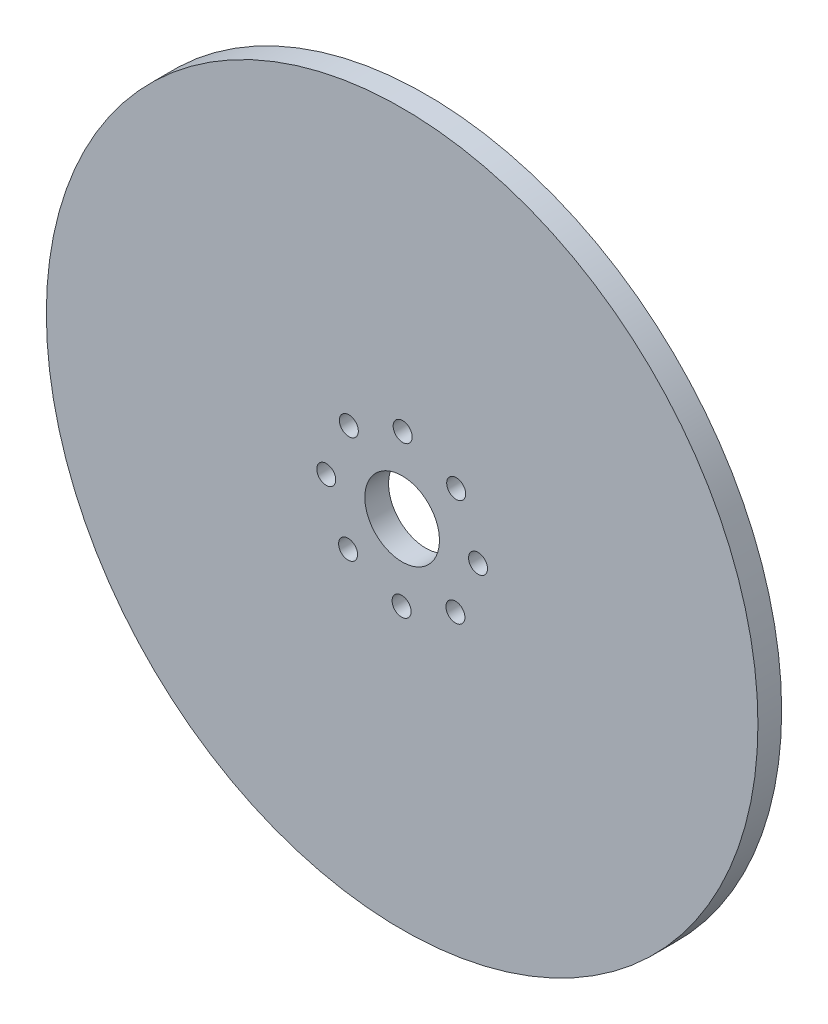
from build123d import *

# Parameters (mm, degrees)
SKETCH1_R           = 37.5
BOSS_EXTRUDE1_DEPTH = 2.5
SKETCH2_R           = 3.933222312
SKETCH2_R_2         = 1
SKETCH2_R_3         = 1.00109015
CUT_EXTRUDE1_DEPTH  = 54.091901454


with BuildPart() as part:
    # Sketch1 → Boss-Extrude1 (new body)
    with BuildSketch(Plane.XY):
        Circle(SKETCH1_R)
    extrude(amount=BOSS_EXTRUDE1_DEPTH)

    # Sketch2 → Cut-Extrude1 (cut, through all)
    with BuildSketch(Plane(origin=(0, 0, 0), x_dir=(-1, 0, 0), z_dir=(0, 0, -1))):
        Circle(SKETCH2_R)
        with Locations((0.056499269, -7.999800487)):
            Circle(SKETCH2_R_2)
        with Locations((-5.616762156, -5.696664189)):
            Circle(SKETCH2_R_2)
        with Locations((-7.999800487, -0.056499269)):
            Circle(SKETCH2_R_2)
        with Locations((-5.696664189, 5.616762156)):
            Circle(SKETCH2_R_2)
        with Locations((-0.056499269, 7.999800487)):
            Circle(SKETCH2_R_3)
        with Locations((5.616762156, 5.696664189)):
            Circle(SKETCH2_R_2)
        with Locations((7.999800487, 0.056499269)):
            Circle(SKETCH2_R_2)
        with Locations((5.696664189, -5.616762156)):
            Circle(SKETCH2_R_2)
    extrude(amount=-CUT_EXTRUDE1_DEPTH, mode=Mode.SUBTRACT)


solid = part.part
